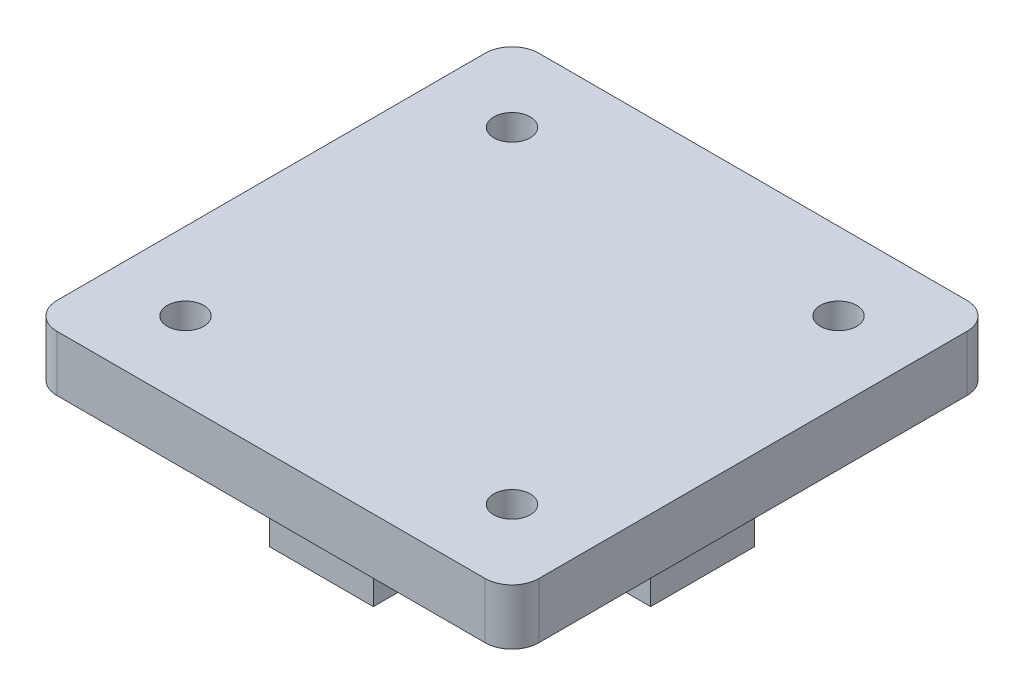
from build123d import *

# Parameters (mm, degrees)
SKETCH1_W               = 45
SKETCH1_H               = 45
BOSS_EXTRUDE1_DEPTH     = 5.2
SKETCH2_W               = 9.7
SKETCH2_H               = 5.8
SKETCH2_W_2             = 5.8
SKETCH2_H_2             = 9.7
BOSS_EXTRUDE2_DEPTH     = 7
CUT_EXTRUDE1_DEPTH      = 35.078438931
CUT_EXTRUDE1_DEPTH_BACK = 35.078438931
SKETCH3_R               = 1.7
CUT_EXTRUDE2_DEPTH      = 2.5
FILLET1_R               = 2.5


with BuildPart() as part:
    # Sketch1 → Boss-Extrude1 (new body)
    with BuildSketch(Plane(origin=(0, 0, 0), x_dir=(1, 0, 0), z_dir=(0, 1, 0))):
        Rectangle(SKETCH1_W, SKETCH1_H)
    extrude(amount=-BOSS_EXTRUDE1_DEPTH)

    # Sketch2 → Boss-Extrude2 (add)
    with BuildSketch(Plane.XZ.offset(5.2)):
        with Locations((0, 14.9)):
            Rectangle(SKETCH2_W, SKETCH2_H)
        with Locations((-14.9, 0)):
            Rectangle(SKETCH2_W_2, SKETCH2_H_2)
        with Locations((14.9, 0)):
            Rectangle(SKETCH2_W_2, SKETCH2_H_2)
        with Locations((0, -14.9)):
            Rectangle(SKETCH2_W, SKETCH2_H)
    extrude(amount=BOSS_EXTRUDE2_DEPTH)

    # Sketch3 → Cut-Extrude1 (cut, two sides: drawn at the far end of the back side and taken through both)
    with BuildSketch(Plane(origin=(0, 0, 0), x_dir=(1, 0, 0), z_dir=(0, 1, 0)).offset(-CUT_EXTRUDE1_DEPTH_BACK)):
        with Locations(Location((-15.25, 15.25, 0), (0, 0, 270))):
            Circle(SKETCH3_R)
        with Locations(Location((15.25, 15.25, 0), (0, 0, 270))):
            Circle(SKETCH3_R)
        with Locations(Location((-15.25, -15.25, 0), (0, 0, 270))):
            Circle(SKETCH3_R)
        with Locations(Location((15.25, -15.25, 0), (0, 0, 270))):
            Circle(SKETCH3_R)
    extrude(amount=CUT_EXTRUDE1_DEPTH + CUT_EXTRUDE1_DEPTH_BACK, mode=Mode.SUBTRACT)

    # Sketch4 → Cut-Extrude2 (cut)
    with BuildSketch(Plane.XZ.offset(5.2)):
        Polygon((12.6, 13.720021787), (15.25, 12.190043573), (17.9, 13.720021787), (17.9, 16.779978213), (15.25, 18.309956427), (12.6, 16.779978213), align=None)
        Polygon((-13.720021787, 12.6), (-12.190043573, 15.25), (-13.720021787, 17.9), (-16.779978213, 17.9), (-18.309956427, 15.25), (-16.779978213, 12.6), align=None)
        Polygon((13.720021787, -12.6), (12.190043573, -15.25), (13.720021787, -17.9), (16.779978213, -17.9), (18.309956427, -15.25), (16.779978213, -12.6), align=None)
        Polygon((-12.6, -13.720021787), (-15.25, -12.190043573), (-17.9, -13.720021787), (-17.9, -16.779978213), (-15.25, -18.309956427), (-12.6, -16.779978213), align=None)
    extrude(amount=-CUT_EXTRUDE2_DEPTH, mode=Mode.SUBTRACT)

    # Fillet1
    fillet1_edges = [part.edges().sort_by_distance(p)[0] for p in [
        (22.5, -2.6, 22.5),
        (-22.5, -2.6, 22.5),
        (-22.5, -2.6, -22.5),
        (22.5, -2.6, -22.5),
    ]]
    fillet(fillet1_edges, radius=FILLET1_R)


solid = part.part
